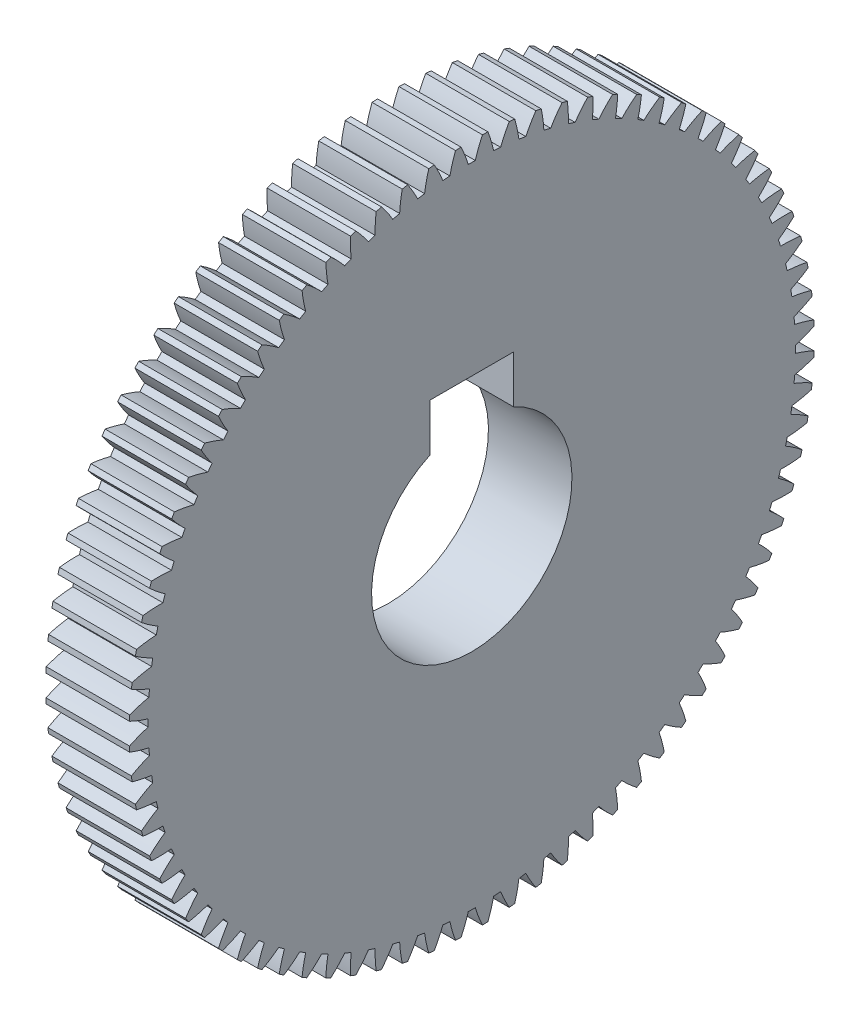
from build123d import *

# Parameters (mm, degrees)
BASPROSKE_W     = 5
BASPROSKE_H     = 20.5
TOOTHCUT_DEPTH  = 30.419381367
TEETHCUTS_COUNT = 80
TEETHCUTS_ANGLE = 355.5
BORSKE_R        = 6
BORE_DEPTH      = 50.0000508
KEYSKE_W        = 5
KEYSKE_H        = 8.3
KEYWAY_DEPTH    = 50.0000508


with BuildPart() as part:
    # BasProSke → Base-Revolve (revolve)
    with BuildSketch(Plane(origin=(0, 0, 0), x_dir=(1, 0, 0), z_dir=(0, 1, 0)), mode=Mode.PRIVATE) as base_revolve_sk:
        with Locations((2.5, 10.25)):
            Rectangle(BASPROSKE_W, BASPROSKE_H)
    revolve(base_revolve_sk.sketch.rotate(Axis((-10, 0, 0), (1, 0, 0)), 180), axis=Axis((-10, 0, 0), (1, 0, 0)))

    # TooCutSke → ToothCut (cut, through all)
    with BuildSketch(Plane(origin=(0, 0, 0), x_dir=(0, 0, -1), z_dir=(1, 0, 0))):
        with BuildLine():
            ThreePointArc((0.210127665, 19.372860459), (0, 19.374), (-0.210127665, 19.372860459))
            ThreePointArc((-0.210127665, 19.372860459), (-0.409130222, 19.952418525), (-0.651908556, 20.515044733))
            ThreePointArc((-0.651908556, 20.515044733), (0, 20.5254), (0.651908556, 20.515044733))
            ThreePointArc((0.651908556, 20.515044733), (0.409130222, 19.952418525), (0.210127665, 19.372860459))
        make_face()
    toothcut = extrude(amount=TOOTHCUT_DEPTH, mode=Mode.SUBTRACT)

    # TeethCuts: ToothCut ×80 about axis
    teethcuts_axis = Axis((-10, 0, 0), (1, 0, 0))
    for i in range(1, TEETHCUTS_COUNT):
        add(toothcut.rotate(teethcuts_axis, i * TEETHCUTS_ANGLE / (TEETHCUTS_COUNT - 1)), mode=Mode.SUBTRACT)

    # BorSke → Bore (cut, symmetric)
    with BuildSketch(Plane(origin=(0, 0, 0), x_dir=(0, 0, -1), z_dir=(1, 0, 0))):
        with Locations(Location((0, 0, 0), (0, 0, 180))):
            Circle(BORSKE_R)
    extrude(amount=BORE_DEPTH, both=True, mode=Mode.SUBTRACT)

    # KeySke → Keyway (cut, symmetric)
    with BuildSketch(Plane(origin=(0, 0, 0), x_dir=(0, 0, -1), z_dir=(1, 0, 0))):
        with Locations((0, 4.15)):
            Rectangle(KEYSKE_W, KEYSKE_H)
    extrude(amount=KEYWAY_DEPTH, both=True, mode=Mode.SUBTRACT)


solid = part.part
